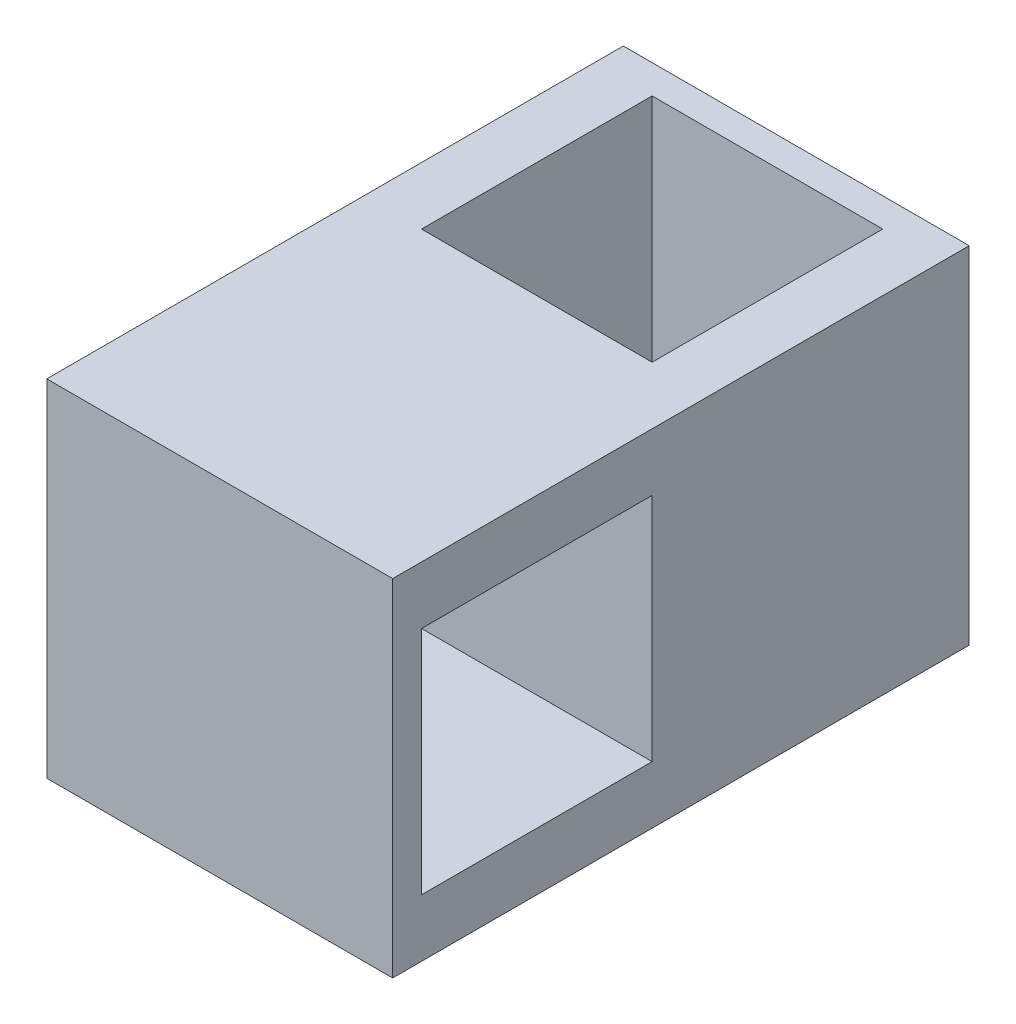
from build123d import *

# Parameters (mm, degrees)
SKETCH1_W           = 30
SKETCH1_H           = 30
BOSS_EXTRUDE1_DEPTH = 50
SKETCH3_W           = 20
SKETCH3_H           = 20
CUT_EXTRUDE1_DEPTH  = 61.207972894
SKETCH4_W           = 20
SKETCH4_H           = 20
CUT_EXTRUDE2_DEPTH  = 61.207972894


with BuildPart() as part:
    # Sketch1 → Boss-Extrude1 (new body)
    with BuildSketch(Plane.XY):
        Rectangle(SKETCH1_W, SKETCH1_H)
    extrude(amount=BOSS_EXTRUDE1_DEPTH)

    # Sketch3 → Cut-Extrude1 (cut, through all)
    with BuildSketch(Plane.ZY.offset(15)):
        with Locations((37.5, 0)):
            Rectangle(SKETCH3_W, SKETCH3_H)
    extrude(amount=-CUT_EXTRUDE1_DEPTH, mode=Mode.SUBTRACT)

    # Sketch4 → Cut-Extrude2 (cut, through all)
    with BuildSketch(Plane(origin=(0, 15, 0), x_dir=(1, 0, 0), z_dir=(0, 1, 0))):
        with Locations((0, -12.5)):
            Rectangle(SKETCH4_W, SKETCH4_H)
    extrude(amount=-CUT_EXTRUDE2_DEPTH, mode=Mode.SUBTRACT)


solid = part.part
